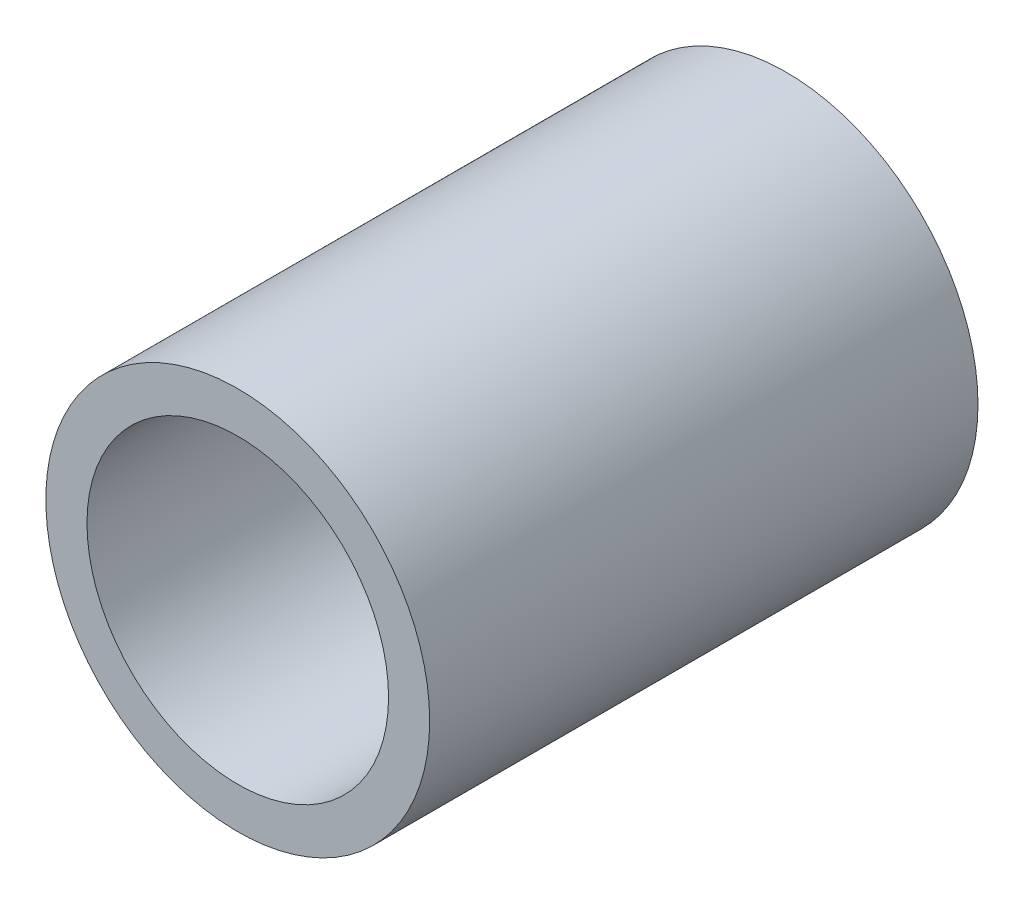
from build123d import *

# Parameters (mm, degrees)
ESQUISSE1_R             = 28
BOSS_EXTRU_1_DEPTH      = 80
ESQUISSE2_R             = 22
ENL_V_MAT_EXTRU_2_DEPTH = 100


with BuildPart() as part:
    # Esquisse1 → Boss.-Extru.1 (new body)
    with BuildSketch(Plane.XY):
        Circle(ESQUISSE1_R)
    extrude(amount=BOSS_EXTRU_1_DEPTH)

    # Esquisse2 → Enlèv. mat.-Extru.2 (cut)
    with BuildSketch(Plane.XY.offset(80)):
        Circle(ESQUISSE2_R)
    extrude(amount=-ENL_V_MAT_EXTRU_2_DEPTH, mode=Mode.SUBTRACT)


solid = part.part
